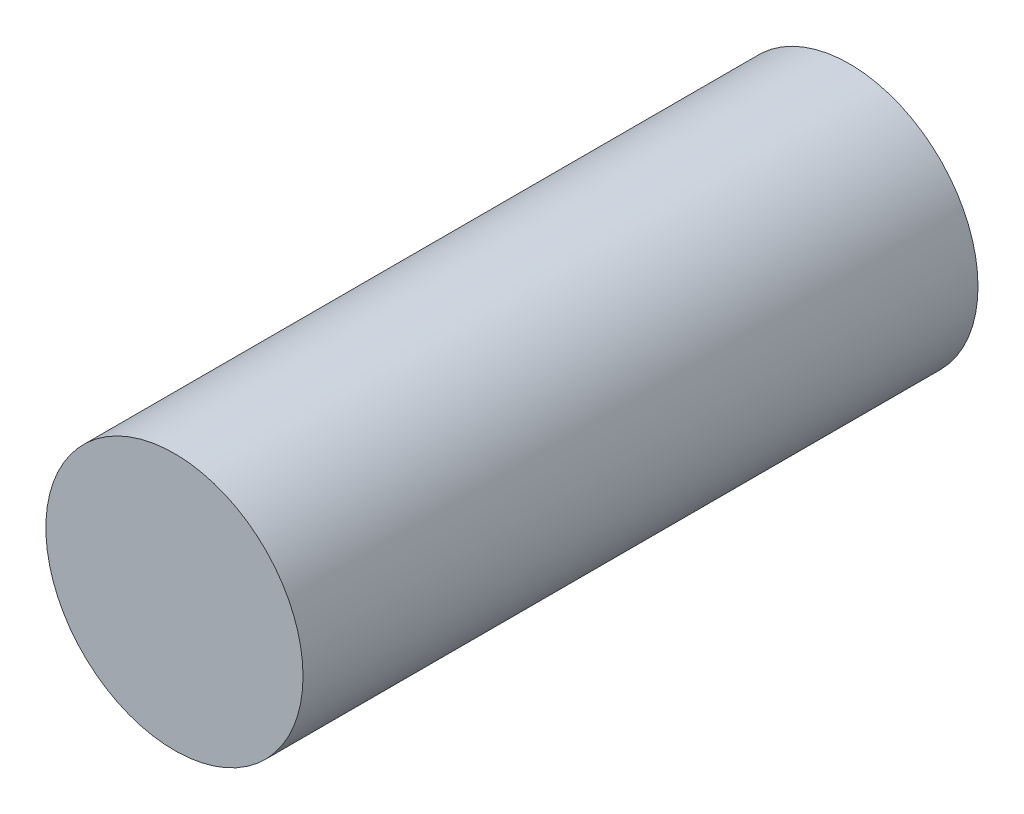
from build123d import *

# Parameters (mm, degrees)
SKETCH1_R           = 9.525
BOSS_EXTRUDE1_DEPTH = 50


with BuildPart() as part:
    # Sketch1 → Boss-Extrude1 (new body)
    with BuildSketch(Plane.XY):
        Circle(SKETCH1_R)
    extrude(amount=BOSS_EXTRUDE1_DEPTH)


solid = part.part
